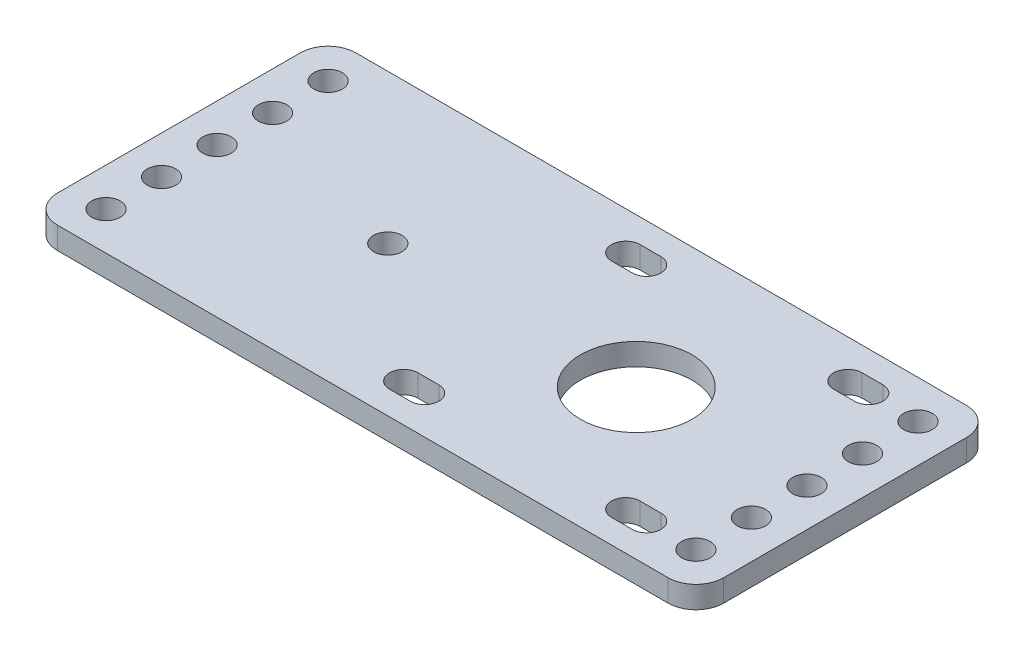
from build123d import *

# Parameters (mm, degrees)
SKETCH1_W           = 96
SKETCH1_H           = 43
SKETCH1_R           = 8.05
SKETCH1_R_2         = 2.05
BOSS_EXTRUDE1_DEPTH = 3.175
FILLET1_R           = 4


with BuildPart() as part:
    # Sketch1 → Boss-Extrude1 (new body)
    with BuildSketch(Plane(origin=(0, 0, 0), x_dir=(1, 0, 0), z_dir=(0, 1, 0))):
        Rectangle(SKETCH1_W, SKETCH1_H)
        with Locations(Location((17.9, 0, 0), (0, 0, 270))):
            Circle(SKETCH1_R, mode=Mode.SUBTRACT)
        with Locations(Location((-17.9, 0, 0), (0, 0, 270))):
            Circle(SKETCH1_R_2, mode=Mode.SUBTRACT)
        with Locations(Location((-42.5, 16, 0), (0, 0, 270))):
            Circle(SKETCH1_R_2, mode=Mode.SUBTRACT)
        with Locations(Location((-42.5, 8, 0), (0, 0, 270))):
            Circle(SKETCH1_R_2, mode=Mode.SUBTRACT)
        with Locations(Location((-42.5, 0, 0), (0, 0, 270))):
            Circle(SKETCH1_R_2, mode=Mode.SUBTRACT)
        with Locations(Location((-42.5, -8, 0), (0, 0, 270))):
            Circle(SKETCH1_R_2, mode=Mode.SUBTRACT)
        with Locations(Location((-42.5, -16, 0), (0, 0, 270))):
            Circle(SKETCH1_R_2, mode=Mode.SUBTRACT)
        with Locations(Location((42.5, 16, 0), (0, 0, 90))):
            Circle(SKETCH1_R_2, mode=Mode.SUBTRACT)
        with Locations(Location((42.5, 8, 0), (0, 0, 90))):
            Circle(SKETCH1_R_2, mode=Mode.SUBTRACT)
        with Locations(Location((42.5, 0, 0), (0, 0, 90))):
            Circle(SKETCH1_R_2, mode=Mode.SUBTRACT)
        with Locations(Location((42.5, -8, 0), (0, 0, 90))):
            Circle(SKETCH1_R_2, mode=Mode.SUBTRACT)
        with Locations(Location((42.5, -16, 0), (0, 0, 90))):
            Circle(SKETCH1_R_2, mode=Mode.SUBTRACT)
        with BuildLine():
            Line((0.4, 18.05), (3.4, 18.05))
            ThreePointArc((3.4, 18.05), (5.45, 16), (3.4, 13.95))
            Line((3.4, 13.95), (0.4, 13.95))
            ThreePointArc((0.4, 13.95), (-1.65, 16), (0.4, 18.05))
        make_face(mode=Mode.SUBTRACT)
        with BuildLine():
            Line((0.4, -13.95), (3.4, -13.95))
            ThreePointArc((3.4, -13.95), (5.45, -16), (3.4, -18.05))
            Line((3.4, -18.05), (0.4, -18.05))
            ThreePointArc((0.4, -18.05), (-1.65, -16), (0.4, -13.95))
        make_face(mode=Mode.SUBTRACT)
        with BuildLine():
            Line((35.4, -18.05), (32.4, -18.05))
            ThreePointArc((32.4, -18.05), (30.35, -16), (32.4, -13.95))
            Line((32.4, -13.95), (35.4, -13.95))
            ThreePointArc((35.4, -13.95), (37.45, -16), (35.4, -18.05))
        make_face(mode=Mode.SUBTRACT)
        with BuildLine():
            Line((35.4, 13.95), (32.4, 13.95))
            ThreePointArc((32.4, 13.95), (30.35, 16), (32.4, 18.05))
            Line((32.4, 18.05), (35.4, 18.05))
            ThreePointArc((35.4, 18.05), (37.45, 16), (35.4, 13.95))
        make_face(mode=Mode.SUBTRACT)
    extrude(amount=BOSS_EXTRUDE1_DEPTH)

    # Fillet1
    fillet1_edges = [part.edges().sort_by_distance(p)[0] for p in [
        (-48, 1.5875, -21.5),
        (48, 1.5875, -21.5),
        (48, 1.5875, 21.5),
        (-48, 1.5875, 21.5),
    ]]
    fillet(fillet1_edges, radius=FILLET1_R)


solid = part.part
